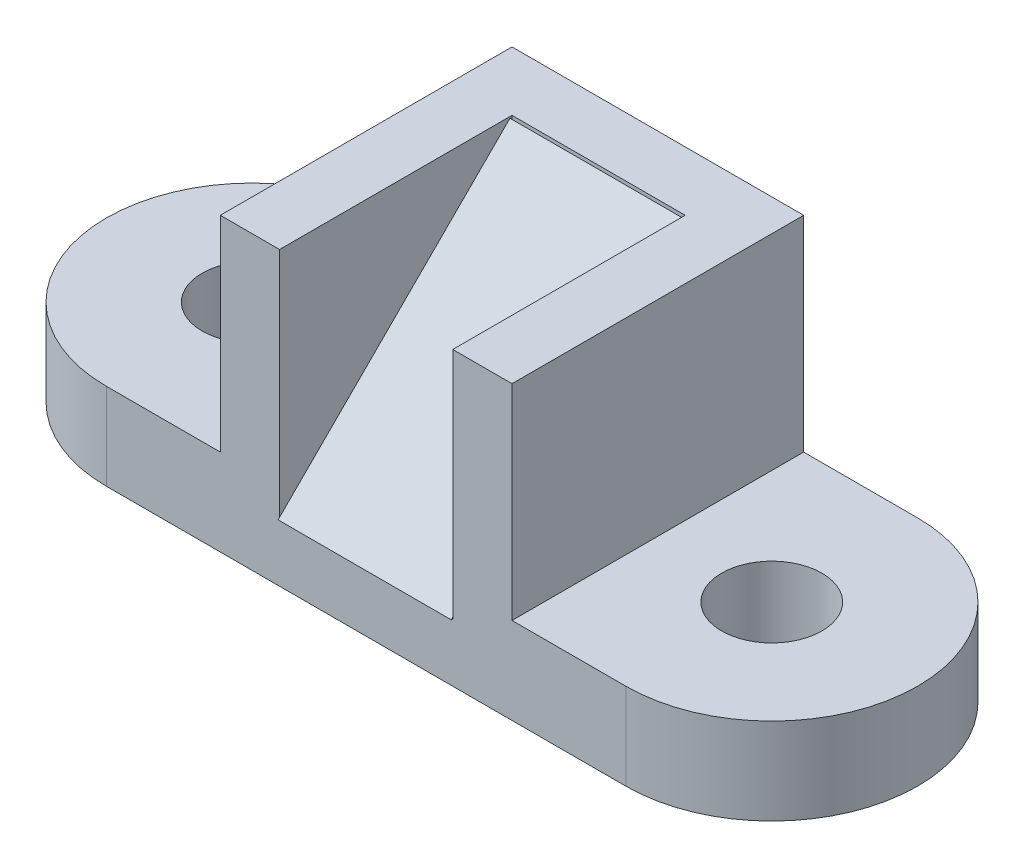
from build123d import *

# Parameters (mm, degrees)
BOSS_EXTRUDE2_DEPTH = 19
SKETCH4_R           = 11
CUT_EXTRUDE1_DEPTH  = 151.668510313
SKETCH5_W           = 64
SKETCH5_H           = 64
BOSS_EXTRUDE3_DEPTH = 45
SKETCH6_W           = 38
SKETCH6_H           = 51
CUT_EXTRUDE2_DEPTH  = 51
BOSS_EXTRUDE4_DEPTH = 38


with BuildPart() as part:
    # Sketch3 → Boss-Extrude2 (new body)
    with BuildSketch(Plane(origin=(0, 0, 0), x_dir=(1, 0, 0), z_dir=(0, 1, 0))):
        with BuildLine():
            Line((0, 32), (114, 32))
            ThreePointArc((114, 32), (146, 0), (114, -32))
            Line((114, -32), (0, -32))
            ThreePointArc((0, -32), (-32, 0), (0, 32))
        make_face()
    extrude(amount=BOSS_EXTRUDE2_DEPTH)

    # Sketch4 → Cut-Extrude1 (cut, through all)
    with BuildSketch(Plane(origin=(0, 19, 0), x_dir=(1, 0, 0), z_dir=(0, 1, 0))):
        with Locations(Location((0, 0, 0), (0, 0, 270))):
            Circle(SKETCH4_R)
        with Locations(Location((114, 0, 0), (0, 0, 90))):
            Circle(SKETCH4_R)
    extrude(amount=-CUT_EXTRUDE1_DEPTH, mode=Mode.SUBTRACT)

    # Sketch5 → Boss-Extrude3 (add)
    with BuildSketch(Plane(origin=(0, 19, 0), x_dir=(1, 0, 0), z_dir=(0, 1, 0))):
        with Locations((57, 0)):
            Rectangle(SKETCH5_W, SKETCH5_H)
    extrude(amount=BOSS_EXTRUDE3_DEPTH)

    # Sketch6 → Cut-Extrude2 (cut)
    with BuildSketch(Plane.XY.offset(32)):
        with Locations((57, 38.5)):
            Rectangle(SKETCH6_W, SKETCH6_H)
    extrude(amount=-CUT_EXTRUDE2_DEPTH, mode=Mode.SUBTRACT)

    # Sketch8 → Boss-Extrude4 (add)
    with BuildSketch(Plane(origin=(38, 0, 0), x_dir=(0, 0, -1), z_dir=(1, 0, 0))):
        Polygon((18.549537032, 63.66671572), (-32.32969233, 12.787486357), (18.549537032, 15.77285286), align=None)
    extrude(amount=BOSS_EXTRUDE4_DEPTH)


solid = part.part
